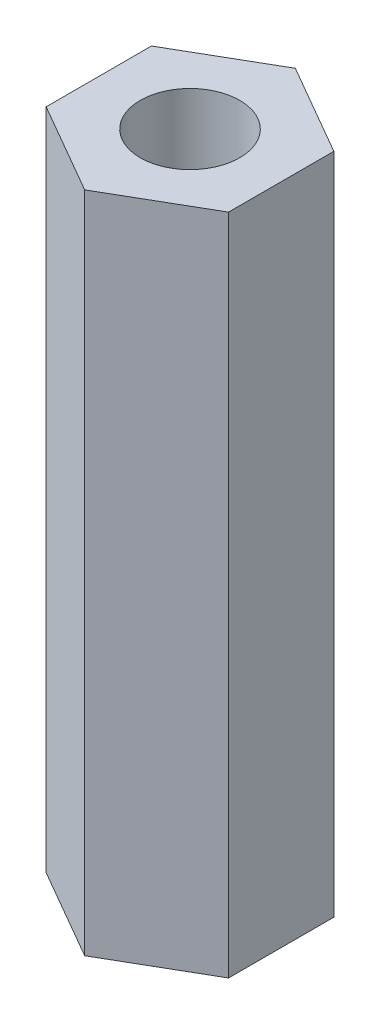
from build123d import *

# Parameters (mm, degrees)
SKETCH_1_R      = 1.5
EXTRUDE_1_DEPTH = 20


with BuildPart() as part:
    # ｽｹｯﾁ1 → ﾎﾞｽ - 押し出し1 (new body)
    with BuildSketch(Plane(origin=(0, 0, 0), x_dir=(1, 0, 0), z_dir=(0, 1, 0))):
        Polygon((0, -3.175426481), (2.75, -1.58771324), (2.75, 1.58771324), (0, 3.175426481), (-2.75, 1.58771324), (-2.75, -1.58771324), align=None)
        with Locations(Location((0, 0, 0), (0, 0, 270))):
            Circle(SKETCH_1_R, mode=Mode.SUBTRACT)
    extrude(amount=EXTRUDE_1_DEPTH)


solid = part.part
